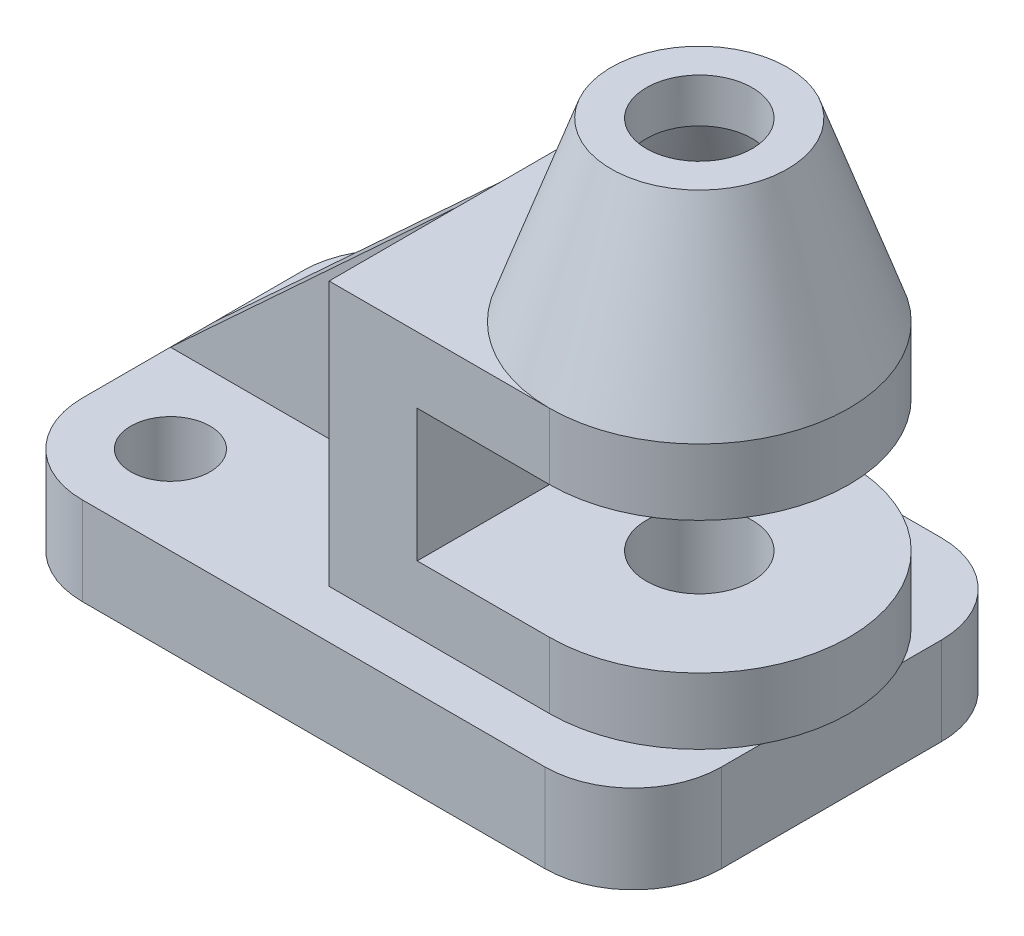
from build123d import *

# Parameters (mm, degrees)
SKETCH1_W           = 145
SKETCH1_H           = 90
SKETCH1_R           = 9
BOSS_EXTRUDE1_DEPTH = 20
FILLET2_R           = 20
BOSS_EXTRUDE3_DEPTH = 60
CUT_EXTRUDE1_START  = -45
CUT_EXTRUDE1_DEPTH  = 30
RIB4_REACH          = 121.487
SKETCH8_WALL_W      = 329.433924144
SKETCH8_WALL_H      = 10
SKETCH18_R          = 12
CUT_EXTRUDE2_DEPTH  = 150.255653159


with BuildPart() as part:
    # Sketch1 → Boss-Extrude1 (new body)
    with BuildSketch(Plane(origin=(0, 0, 0), x_dir=(1, 0, 0), z_dir=(0, 1, 0))):
        Rectangle(SKETCH1_W, SKETCH1_H)
        with Locations(Location((-52.5, 25, 0), (0, 0, 270))):
            Circle(SKETCH1_R, mode=Mode.SUBTRACT)
        with Locations(Location((-52.5, -25, 0), (0, 0, 270))):
            Circle(SKETCH1_R, mode=Mode.SUBTRACT)
    extrude(amount=BOSS_EXTRUDE1_DEPTH)

    # Fillet2
    fillet2_edges = [part.edges().sort_by_distance(p)[0] for p in [
        (72.5, 10, 45),
        (-72.5, 10, 45),
        (-72.5, 10, -45),
        (72.5, 10, -45),
    ]]
    fillet(fillet2_edges, radius=FILLET2_R)

    # Sketch2 → Boss-Extrude3 (add)
    with BuildSketch(Plane(origin=(0, 20, 0), x_dir=(1, 0, 0), z_dir=(0, 1, 0))):
        with BuildLine():
            Line((-7.5, 34), (-7.5, -34))
            Line((-7.5, -34), (42.5, -34))
            ThreePointArc((42.5, -34), (76.5, 0), (42.5, 34))
            Line((42.5, 34), (-7.5, 34))
        make_face()
    extrude(amount=BOSS_EXTRUDE3_DEPTH)

    # Sketch3 → Cut-Extrude1 (cut)
    with BuildSketch(Plane(origin=(0, 80, 0), x_dir=(1, 0, 0), z_dir=(0, 1, 0)).offset(CUT_EXTRUDE1_START)):
        with BuildLine():
            Line((42.5, 34), (12.5, 34))
            Line((12.5, 34), (12.5, -34))
            Line((12.5, -34), (42.5, -34))
            ThreePointArc((42.5, -34), (76.5, 0), (42.5, 34))
        make_face()
    extrude(amount=CUT_EXTRUDE1_DEPTH, mode=Mode.SUBTRACT)

    # Sketch8 wall → Rib4 (add, up to next)
    with BuildSketch(Plane(origin=(-40, 50, 0), x_dir=(-0.734803444627, -0.678280102733, 0), z_dir=(0.678280102733, -0.734803444627, 0)), mode=Mode.PRIVATE) as rib4_sk1:
        Rectangle(SKETCH8_WALL_W, SKETCH8_WALL_H)
    rib4_tool1 = extrude(rib4_sk1.sketch, amount=RIB4_REACH, mode=Mode.PRIVATE) - part.part
    add(rib4_tool1.solids().sort_by_distance((-40, 50, 0))[0])

    # Sketch17 → Revolve-Thin1 (revolve)
    with BuildSketch(Plane(origin=(42.5, 0, 0), x_dir=(0, 0, -1), z_dir=(1, 0, 0))):
        Polygon((0, 80), (0, 120), (20, 120), (34, 80), (24.561416436, 76.696495753), (12.90518995, 110), (10, 110), (10, 80), align=None)
    revolve(axis=Axis((42.5, 80, 0), (0, 1, 0)))

    # Sketch18 → Cut-Extrude2 (cut, through all)
    with BuildSketch(Plane(origin=(0, 120, 0), x_dir=(1, 0, 0), z_dir=(0, 1, 0))):
        with Locations(Location((42.5, 0, 0), (0, 0, 270))):
            Circle(SKETCH18_R)
    extrude(amount=-CUT_EXTRUDE2_DEPTH, mode=Mode.SUBTRACT)


solid = part.part
